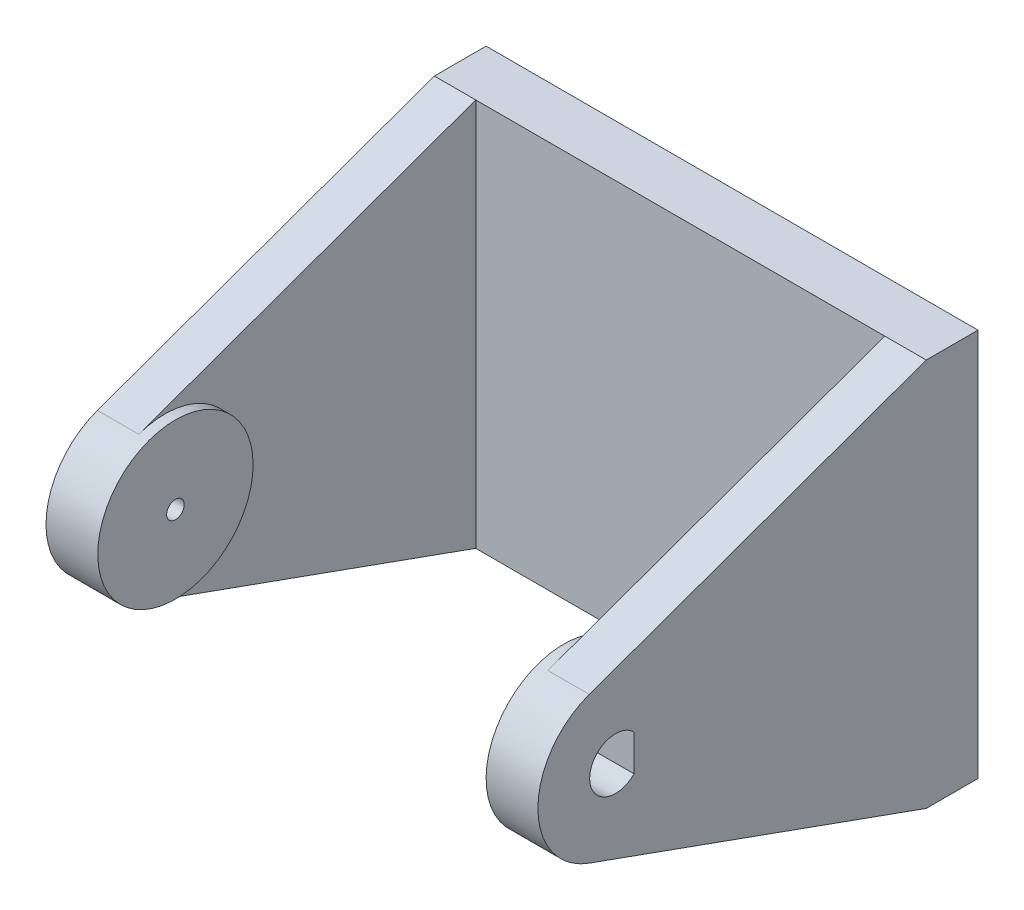
from build123d import *
from build123d.topology import SkipClean

# Parameters (mm, degrees)
SKETCH1_R                                       = 7.5
BOSS_EXTRUDE1_DEPTH                             = 10
SKETCH2_W                                       = 95
SKETCH2_H                                       = 75
BOSS_EXTRUDE2_DEPTH                             = 10
LPATTERN1_COUNT                                 = 2
LPATTERN1_PITCH                                 = 85
CUT_EXTRUDE2_DEPTH                              = 77
CUT_EXTRUDE2_DEPTH_BACK                         = 2
SKETCH5_R                                       = 7.5
SKETCH5_R_2                                     = 1
BOSS_EXTRUDE4_DEPTH                             = 10
CSK_FOR_M3_FLAT_HEAD_MACHINE_SCREW1_D           = 3.4
CSK_FOR_M3_FLAT_HEAD_MACHINE_SCREW1_DEPTH       = 95
CSK_FOR_M3_FLAT_HEAD_MACHINE_SCREW1_CSINK_D     = 6.3
CSK_FOR_M3_FLAT_HEAD_MACHINE_SCREW1_CSINK_ANGLE = 90
BOSS_EXTRUDE5_START                             = -10
SKETCH10_R                                      = 7.5
BOSS_EXTRUDE5_DEPTH                             = 10


with BuildPart() as part:
    # Sketch1 → Boss-Extrude1 (new body)
    with BuildSketch(Plane.YZ):
        with BuildLine():
            Line((-14.116239718, 5.072649824), (-37.5, -60))
            Line((-37.5, -60), (37.5, -60))
            Line((37.5, -60), (14.116239718, 5.072649824))
            ThreePointArc((14.116239718, 5.072649824), (0, 15), (-14.116239718, 5.072649824))
        make_face()
        with Locations(Location((0, 0, 0), (0, 0, 270))):
            Circle(SKETCH1_R, mode=Mode.SUBTRACT)
    boss_extrude1 = extrude(amount=BOSS_EXTRUDE1_DEPTH)

    # Sketch2 → Boss-Extrude2 (add)
    with BuildSketch(Plane(origin=(0, 0, -60), x_dir=(1, 0, 0), z_dir=(0, 0, -1))):
        with Locations((47.5, 0)):
            Rectangle(SKETCH2_W, SKETCH2_H)
    extrude(amount=BOSS_EXTRUDE2_DEPTH)

    # LPattern1: Boss-Extrude1 ×2
    with Locations(*[(i * LPATTERN1_PITCH, 0, 0) for i in range(1, LPATTERN1_COUNT)]):
        add(boss_extrude1)

    # Sketch4 → Cut-Extrude2 (cut, two sides: drawn at the far end of the back side and taken through both)
    with SkipClean():  # the faces are left unmerged after this step: merging them gives an invalid solid
        with BuildSketch(Plane.YZ.offset(10).offset(-CUT_EXTRUDE2_DEPTH_BACK)):
            with BuildLine():
                Line((-37.5, -60), (37.5, -60))
                Line((37.5, -60), (14.116239718, 5.072649824))
                ThreePointArc((14.116239718, 5.072649824), (14.777408362, 2.574529494), (15, 0))
                ThreePointArc((15, 0), (-2.574529494, -14.777408362), (-14.116239718, 5.072649824))
                Line((-14.116239718, 5.072649824), (-37.5, -60))
            make_face()
        extrude(amount=CUT_EXTRUDE2_DEPTH + CUT_EXTRUDE2_DEPTH_BACK, mode=Mode.SUBTRACT)

    # Sketch5 → Boss-Extrude4 (add)
    with SkipClean():  # the faces are left unmerged after this step: merging them gives an invalid solid
        with BuildSketch(Plane.YZ):
            with Locations(Location((0, 0, 0), (0, 0, 270))):
                Circle(SKETCH5_R)
            with Locations(Location((0, 0, 0), (0, 0, 270))):
                Circle(SKETCH5_R_2, mode=Mode.SUBTRACT)
        extrude(amount=BOSS_EXTRUDE4_DEPTH)

    # CSK for M3 Flat Head Machine Screw1
    with Locations(Plane(origin=(0, 0, 0), x_dir=(0, -1, 0), z_dir=(-1, 0, 0))):
        with Locations((0, 0)):
            CounterSinkHole(CSK_FOR_M3_FLAT_HEAD_MACHINE_SCREW1_D / 2, CSK_FOR_M3_FLAT_HEAD_MACHINE_SCREW1_CSINK_D / 2, depth=CSK_FOR_M3_FLAT_HEAD_MACHINE_SCREW1_DEPTH, counter_sink_angle=CSK_FOR_M3_FLAT_HEAD_MACHINE_SCREW1_CSINK_ANGLE)

    # Sketch10 → Boss-Extrude5 (add)
    with SkipClean():  # the faces are left unmerged after this step: merging them gives an invalid solid
        with BuildSketch(Plane.YZ.offset(95).offset(BOSS_EXTRUDE5_START)):
            Circle(SKETCH10_R)
            with BuildLine():
                Line((-3.5, -3.570714214), (3.5, -3.570714214))
                ThreePointArc((3.5, -3.570714214), (0, 5), (-3.5, -3.570714214))
            make_face(mode=Mode.SUBTRACT)
        extrude(amount=BOSS_EXTRUDE5_DEPTH)


solid = part.part
